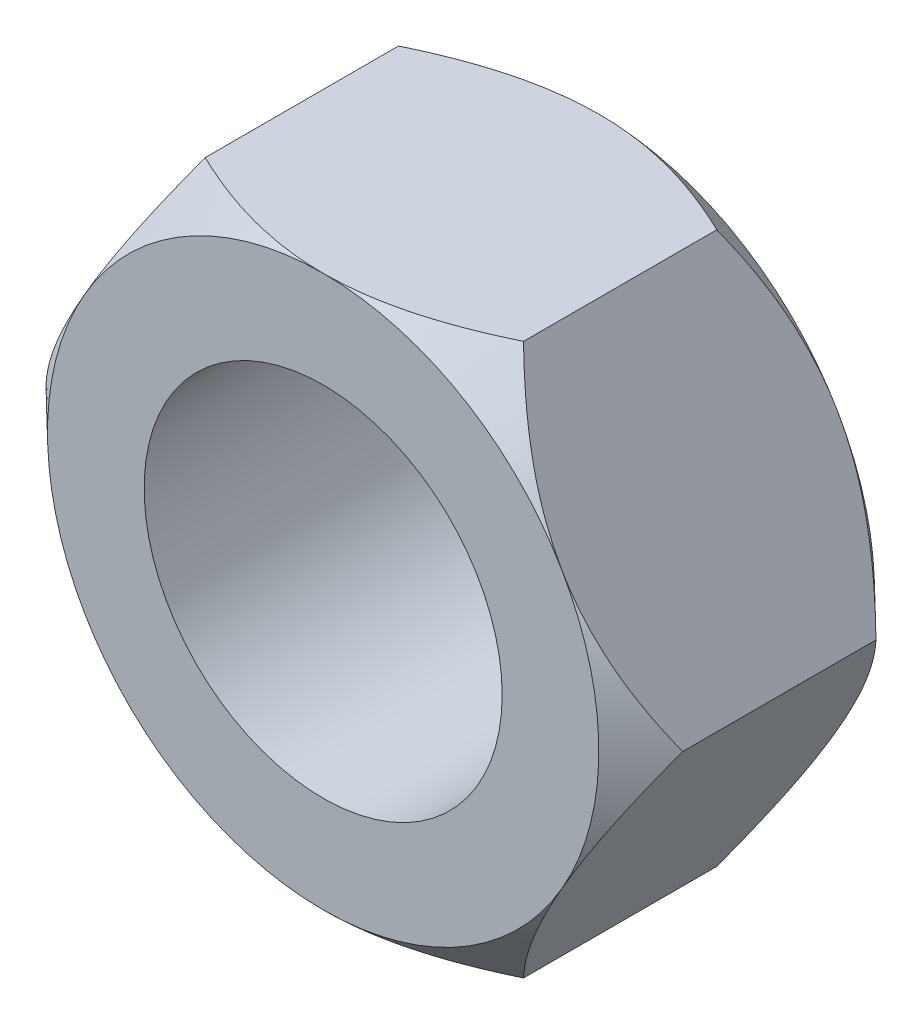
from build123d import *

# Parameters (mm, degrees)
CROQUIS1_R              = 7.14375
SALIENTE_EXTRUIR1_DEPTH = 11
CROQUIS2_R              = 31.223063066
CROQUIS2_R_2            = 11
CORTAR_EXTRUIR1_DEPTH   = 10
CORTAR_EXTRUIR1_DRAFT   = -46
CROQUIS4_R              = 40.862675885
CROQUIS4_R_2            = 11
CORTAR_EXTRUIR3_DEPTH   = 10
CORTAR_EXTRUIR3_DRAFT   = -46


with BuildPart() as part:
    # Croquis1 → Saliente-Extruir1 (new body)
    with BuildSketch(Plane.XY):
        Polygon((12.701705922, 0), (6.350852961, 11), (-6.350852961, 11), (-12.701705922, 0), (-6.350852961, -11), (6.350852961, -11), align=None)
        Circle(CROQUIS1_R, mode=Mode.SUBTRACT)
    extrude(amount=SALIENTE_EXTRUIR1_DEPTH)


with BuildPart() as cortar_extruir1_tool:
    # Croquis2 → Cortar-Extruir1 (with draft: the straight prism first)
    with BuildSketch(Plane.XY.offset(11)):
        Circle(CROQUIS2_R)
        Circle(CROQUIS2_R_2, mode=Mode.SUBTRACT)
    extrude(amount=-CORTAR_EXTRUIR1_DEPTH)
    # Cortar-Extruir1: the draft: its side faces are tilted about the plane it starts from
    cortar_extruir1_sides = [cortar_extruir1_tool.faces().sort_by_distance(p)[0] for p in [
        (-31.223063066, 0, 6),
        (-11, 0, 6),
    ]]
    draft(cortar_extruir1_sides, Plane.XY.offset(11), CORTAR_EXTRUIR1_DRAFT)


with BuildPart() as part_1:
    add(part.part)

    # Cortar-Extruir1: cut by cortar_extruir1_tool
    add(cortar_extruir1_tool.part, mode=Mode.SUBTRACT)


with BuildPart() as cortar_extruir3_tool:
    # Croquis4 → Cortar-Extruir3 (with draft: the straight prism first)
    with BuildSketch(Plane(origin=(0, 0, 0), x_dir=(-1, 0, 0), z_dir=(0, 0, -1))):
        Circle(CROQUIS4_R)
        Circle(CROQUIS4_R_2, mode=Mode.SUBTRACT)
    extrude(amount=-CORTAR_EXTRUIR3_DEPTH)
    # Cortar-Extruir3: the draft: its side faces are tilted about the plane it starts from
    cortar_extruir3_sides = [cortar_extruir3_tool.faces().sort_by_distance(p)[0] for p in [
        (40.862675885, 0, 5),
        (11, 0, 5),
    ]]
    draft(cortar_extruir3_sides, Plane(origin=(0, 0, 0), x_dir=(-1, 0, 0), z_dir=(0, 0, -1)), CORTAR_EXTRUIR3_DRAFT)


with BuildPart() as part_2:
    add(part_1.part)

    # Cortar-Extruir3: cut by cortar_extruir3_tool
    add(cortar_extruir3_tool.part, mode=Mode.SUBTRACT)


solid = part_2.part
